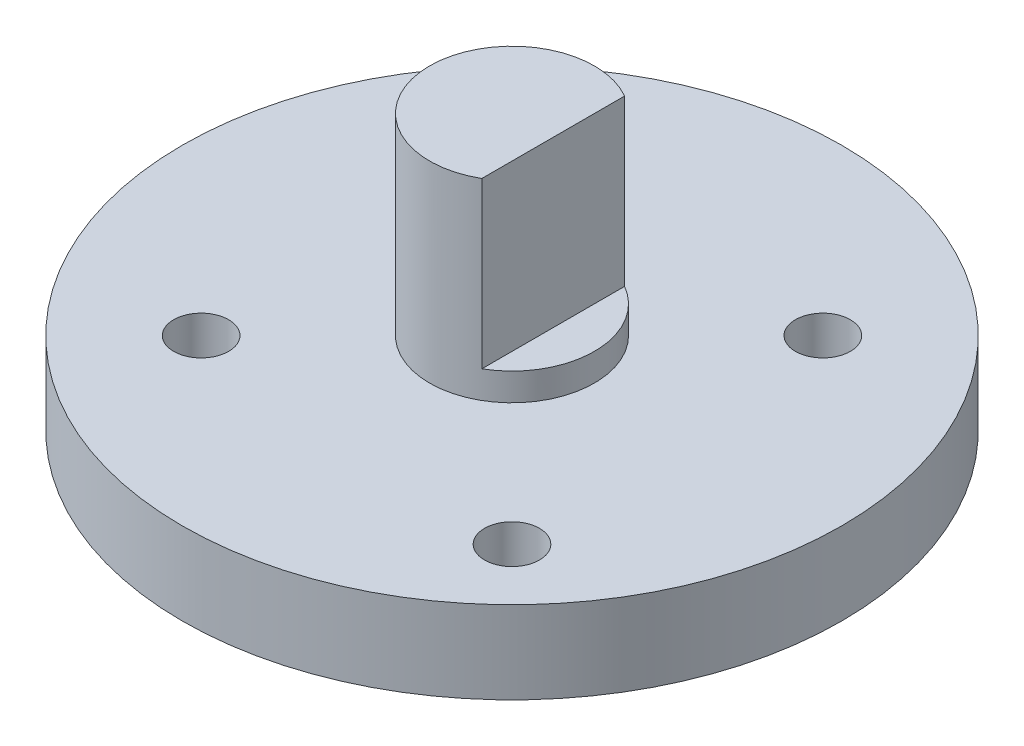
from build123d import *

# Parameters (mm, degrees)
CROQUIS1_R              = 12
CROQUIS1_R_2            = 1
SALIENTE_EXTRUIR1_DEPTH = 3
SALIENTE_EXTRUIR2_START = 3
CROQUIS1_3_R            = 3
SALIENTE_EXTRUIR2_DEPTH = 7
CORTAR_EXTRUIR1_START   = -6
CORTAR_EXTRUIR1_DEPTH   = 6


with BuildPart() as part:
    # Croquis1 → Saliente-Extruir1 (new body)
    with BuildSketch(Plane(origin=(0, 0, 0), x_dir=(1, 0, 0), z_dir=(0, 1, 0))):
        with Locations(Location((0, 0, 0), (0, 0, 270))):
            Circle(CROQUIS1_R)
        with Locations(Location((-6.576093065, 6.576093065, 0), (0, 0, 270))):
            Circle(CROQUIS1_R_2, mode=Mode.SUBTRACT)
        with Locations(Location((6.576093065, -6.576093065, 0), (0, 0, 270))):
            Circle(CROQUIS1_R_2, mode=Mode.SUBTRACT)
        with Locations(Location((5.656854249, 5.656854249, 0), (0, 0, 270))):
            Circle(CROQUIS1_R_2, mode=Mode.SUBTRACT)
        with Locations(Location((-5.656854249, -5.656854249, 0), (0, 0, 270))):
            Circle(CROQUIS1_R_2, mode=Mode.SUBTRACT)
    extrude(amount=SALIENTE_EXTRUIR1_DEPTH)

    # Croquis1<3> → Saliente-Extruir2 (add)
    with BuildSketch(Plane(origin=(0, 0, 0), x_dir=(1, 0, 0), z_dir=(0, 1, 0)).offset(SALIENTE_EXTRUIR2_START)):
        with Locations(Location((0, 0, 0), (0, 0, 270))):
            Circle(CROQUIS1_3_R)
    extrude(amount=SALIENTE_EXTRUIR2_DEPTH)

    # Croquis2 → Cortar-Extruir1 (cut)
    with BuildSketch(Plane(origin=(0, 10, 0), x_dir=(1, 0, 0), z_dir=(0, 1, 0)).offset(CORTAR_EXTRUIR1_START)):
        with BuildLine():
            Line((1.5, 2.598076211), (1.5, -2.598076211))
            ThreePointArc((1.5, -2.598076211), (3, 0), (1.5, 2.598076211))
        make_face()
    extrude(amount=CORTAR_EXTRUIR1_DEPTH, mode=Mode.SUBTRACT)


solid = part.part
